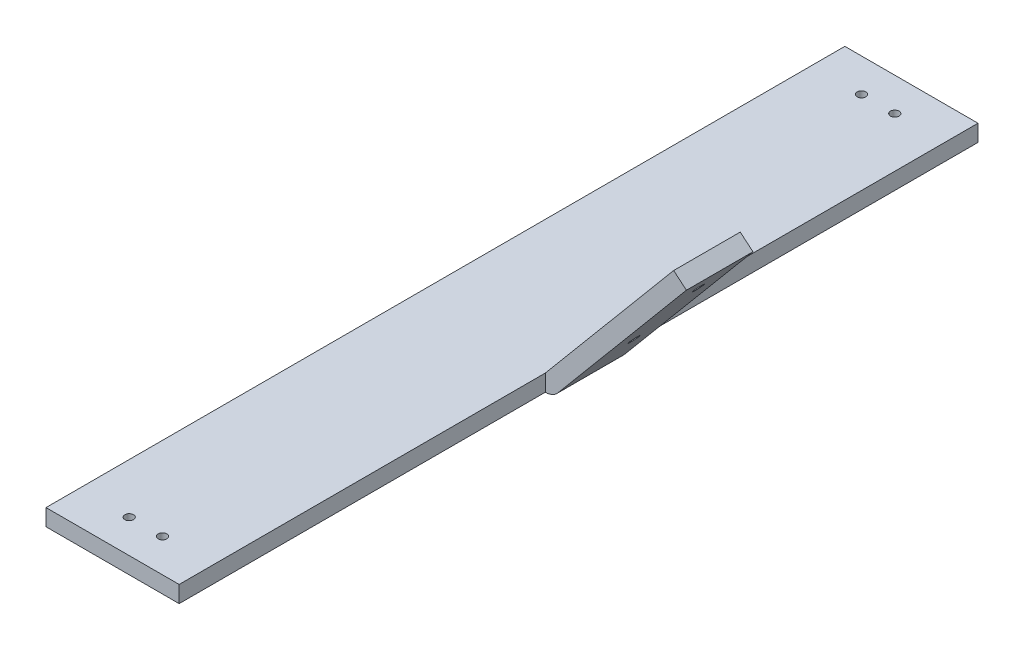
from build123d import *

# Parameters (mm, degrees)
BOSS_EXTRUDE1_START = -152.4
SKETCH1_W           = 50.8
SKETCH1_H           = 6.35
BOSS_EXTRUDE1_DEPTH = 304.8
BOSS_EXTRUDE2_START = -12.7
BOSS_EXTRUDE2_DEPTH = 25.4
SKETCH2_R           = 1.651
CUT_EXTRUDE2_DEPTH  = 25.4
SKETCH3_R           = 1.9304
CUT_EXTRUDE4_DEPTH  = 25.4


with BuildPart() as part:
    # Sketch1 → Boss-Extrude1 (new body)
    with BuildSketch(Plane.XY.offset(BOSS_EXTRUDE1_START)):
        with Locations((25.4, -3.175)):
            Rectangle(SKETCH1_W, SKETCH1_H)
    extrude(amount=BOSS_EXTRUDE1_DEPTH)

    # Sketch1<7> → Boss-Extrude2 (add)
    with BuildSketch(Plane.XY.offset(BOSS_EXTRUDE2_START)):
        with BuildLine():
            ThreePointArc((50.8, -6.35), (53.483625962, -5.755054448), (55.664382214, -4.081701322))
            Line((55.664382214, -4.081701322), (104.644798072, 54.290885244))
            Line((104.644798072, 54.290885244), (99.780415858, 58.372586566))
            Line((99.780415858, 58.372586566), (50.8, 0))
            Line((50.8, 0), (50.8, -6.35))
        make_face()
    extrude(amount=BOSS_EXTRUDE2_DEPTH)

    # Sketch2 → Cut-Extrude2 (cut)
    with BuildSketch(Plane(origin=(0, 0, 0), x_dir=(1, 0, 0), z_dir=(0, 1, 0))):
        with Locations(Location((19.05, -139.7, 0), (0, 0, 270))):
            Circle(SKETCH2_R)
        with Locations(Location((31.75, -139.7, 0), (0, 0, 270))):
            Circle(SKETCH2_R)
        with Locations(Location((31.75, 139.7, 0), (0, 0, 270))):
            Circle(SKETCH2_R)
        with Locations(Location((19.05, 139.7, 0), (0, 0, 270))):
            Circle(SKETCH2_R)
    extrude(amount=-CUT_EXTRUDE2_DEPTH, mode=Mode.SUBTRACT)

    # Sketch3 → Cut-Extrude4 (cut)
    with BuildSketch(Plane(origin=(29.810663713, -25.014116927, 0), x_dir=(0.6427876096865373, 0.7660444431189797, 0), z_dir=(-0.7660444431189798, 0.6427876096865374, 0))):
        with Locations(Location((96.153610572, 0, 0), (0, 0, 180))):
            Circle(SKETCH3_R)
        with Locations(Location((58.053610572, 0, 0), (0, 0, 180))):
            Circle(SKETCH3_R)
    extrude(amount=-CUT_EXTRUDE4_DEPTH, mode=Mode.SUBTRACT)


solid = part.part
